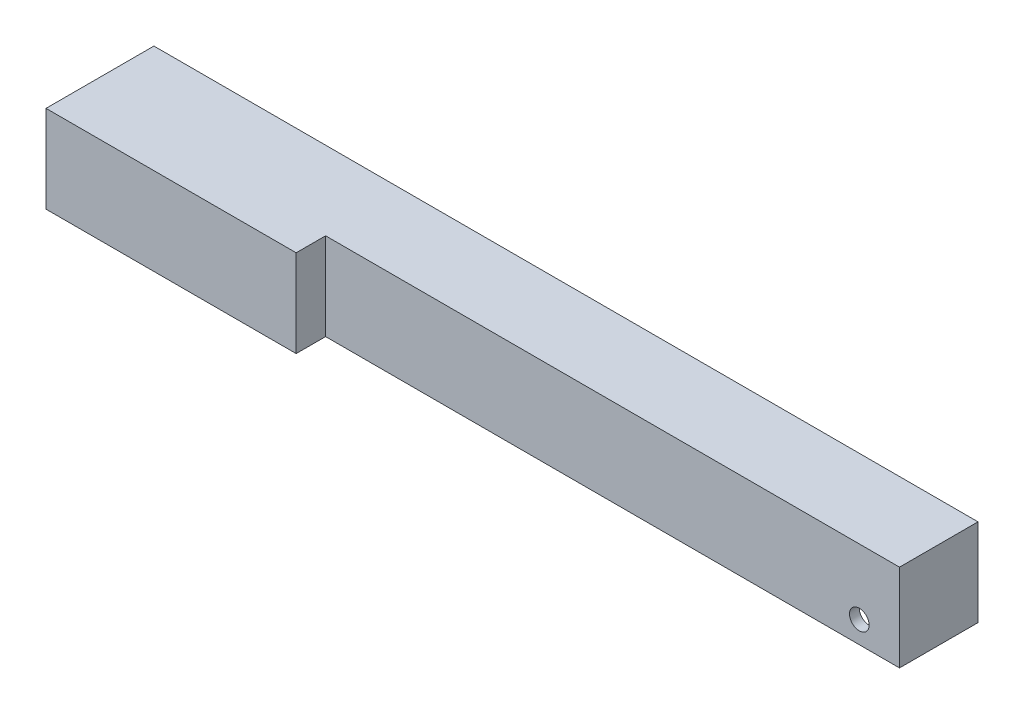
from build123d import *

# Parameters (mm, degrees)
SKETCH1_W           = 168
SKETCH1_H           = 22
BOSS_EXTRUDE1_DEPTH = 17.8
SKETCH8_R           = 2
CUT_EXTRUDE4_DEPTH  = 22
CUT_EXTRUDE2_REACH  = 88.567
SKETCH5_W           = 117
SKETCH5_H           = 6
CUT_EXTRUDE3_DEPTH  = 15.8
BOSS_EXTRUDE2_REACH = 90.164
SKETCH9_W           = 47
SKETCH9_H           = 2


with BuildPart() as part:
    # Sketch1 → Boss-Extrude1 (new body)
    with BuildSketch(Plane(origin=(0, 0, 0), x_dir=(1, 0, 0), z_dir=(0, 1, 0))):
        Rectangle(SKETCH1_W, SKETCH1_H)
    extrude(amount=-BOSS_EXTRUDE1_DEPTH)

    # Sketch8 → Cut-Extrude4 (cut)
    with BuildSketch(Plane.XY.offset(11)):
        with Locations((75.8, -13.35)):
            Circle(SKETCH8_R)
    extrude(amount=-CUT_EXTRUDE4_DEPTH, mode=Mode.SUBTRACT)

    # Cut-Extrude2: up to this face of the body (flat: up to its plane)
    cut_extrude2_end = Plane(part.part.faces().sort_by_distance((0, -17.8, 0))[0])
    # Sketch5 → Cut-Extrude2 (cut, up to the picked face)
    with BuildSketch(Plane(origin=(0, 0, 0), x_dir=(1, 0, 0), z_dir=(0, 1, 0)), mode=Mode.PRIVATE) as cut_extrude2_sk1:
        with Locations((25.5, -8)):
            Rectangle(SKETCH5_W, SKETCH5_H)
    cut_extrude2_tool1 = split(extrude(cut_extrude2_sk1.sketch, amount=-CUT_EXTRUDE2_REACH, mode=Mode.PRIVATE), bisect_by=cut_extrude2_end, keep=Keep.BOTH, mode=Mode.PRIVATE)
    add(cut_extrude2_tool1.solids().sort_by(Axis((25.5, 0, 8), (0, -1, 0)))[0], mode=Mode.SUBTRACT)

    # Sketch6 → Cut-Extrude3 (cut)
    with BuildSketch(Plane.XZ.offset(17.8)):
        Polygon((-82, 9), (-82, -9), (82, -9), (82, 3), (-35, 3), (-35, 9), align=None)
    extrude(amount=-CUT_EXTRUDE3_DEPTH, mode=Mode.SUBTRACT)

    # Boss-Extrude2: up to this face of the body (flat: up to its plane)
    boss_extrude2_end = Plane(part.part.faces().sort_by_distance((-0.369393652, -9.883187228, -9))[0])
    # Sketch9 → Boss-Extrude2 (add, up to the picked face)
    with BuildSketch(Plane(origin=(0, 0, 9), x_dir=(-1, 0, 0), z_dir=(0, 0, -1)), mode=Mode.PRIVATE) as boss_extrude2_sk1:
        with Locations((58.5, -13.3)):
            Rectangle(SKETCH9_W, SKETCH9_H)
    boss_extrude2_tool1 = split(extrude(boss_extrude2_sk1.sketch, amount=BOSS_EXTRUDE2_REACH, mode=Mode.PRIVATE), bisect_by=boss_extrude2_end, keep=Keep.BOTH, mode=Mode.PRIVATE)
    add(boss_extrude2_tool1.solids().sort_by(Axis((-58.5, -13.3, 9), (0, 0, -1)))[0])


solid = part.part
